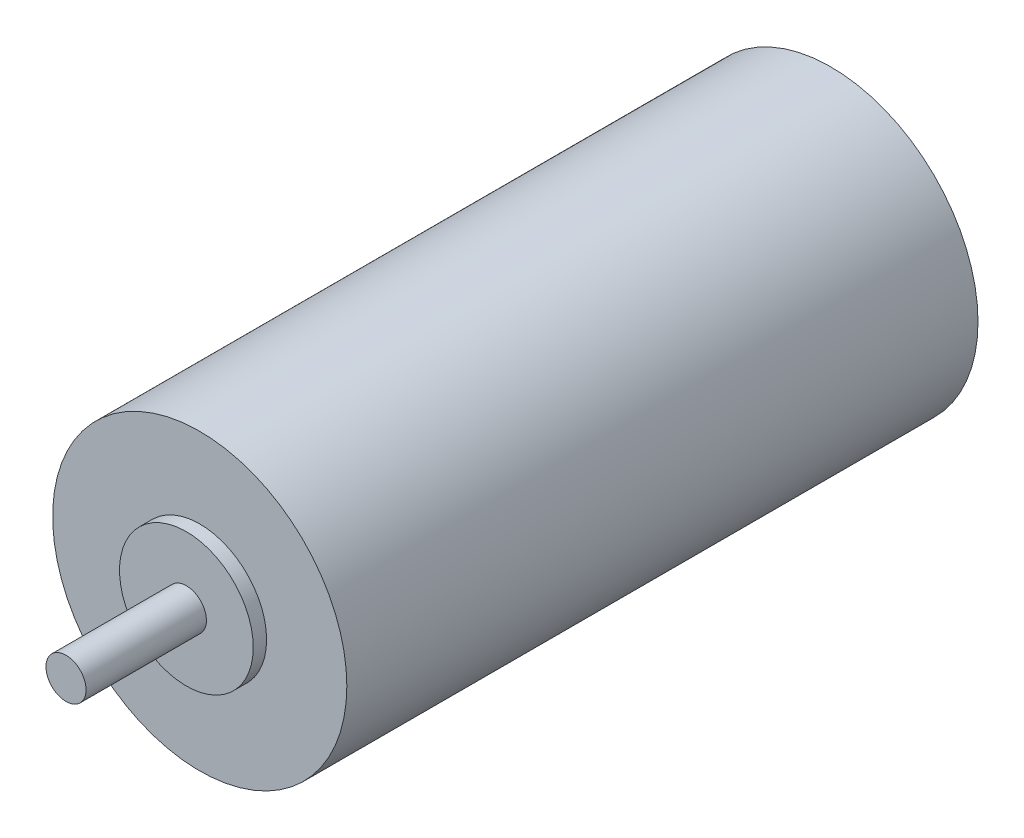
from build123d import *

# Parameters (mm, degrees)
SKETCH1_R           = 11
BOSS_EXTRUDE1_DEPTH = 47.2
SKETCH2_W           = 1
SKETCH2_H           = 5
SKETCH3_W           = 2.3
SKETCH3_H           = 3
SKETCH4_R           = 1.5
BOSS_EXTRUDE2_DEPTH = 9
SKETCH5_R           = 1
BOSS_EXTRUDE3_DEPTH = 2.65


with BuildPart() as part:
    # Sketch1 → Boss-Extrude1 (new body)
    with BuildSketch(Plane.XY):
        Circle(SKETCH1_R)
    extrude(amount=BOSS_EXTRUDE1_DEPTH)

    # Sketch2 → Revolve1 (revolve)
    with BuildSketch(Plane(origin=(0, 0, 0), x_dir=(0, 0, -1), z_dir=(1, 0, 0)), mode=Mode.PRIVATE) as revolve1_sk:
        with Locations((-47.7, 2.5)):
            Rectangle(SKETCH2_W, SKETCH2_H)
    revolve(revolve1_sk.sketch.rotate(Axis((0, 0, 47.2), (0, 0, -1)), 90), axis=Axis((0, 0, 47.2), (0, 0, -1)))

    # Sketch3 → Revolve2 (revolve)
    with BuildSketch(Plane(origin=(0, 0, 0), x_dir=(0, 0, -1), z_dir=(1, 0, 0)), mode=Mode.PRIVATE) as revolve2_sk:
        with Locations((1.15, 1.5)):
            Rectangle(SKETCH3_W, SKETCH3_H)
    revolve(revolve2_sk.sketch.rotate(Axis((0, 0, 47.2), (0, 0, -1)), 90), axis=Axis((0, 0, 47.2), (0, 0, -1)))

    # Sketch4 → Boss-Extrude2 (add)
    with BuildSketch(Plane.XY.offset(48.2)):
        Circle(SKETCH4_R)
    extrude(amount=BOSS_EXTRUDE2_DEPTH)

    # Sketch5 → Boss-Extrude3 (add)
    with BuildSketch(Plane(origin=(0, 0, -2.3), x_dir=(-1, 0, 0), z_dir=(0, 0, -1))):
        Circle(SKETCH5_R)
    extrude(amount=BOSS_EXTRUDE3_DEPTH)


solid = part.part
